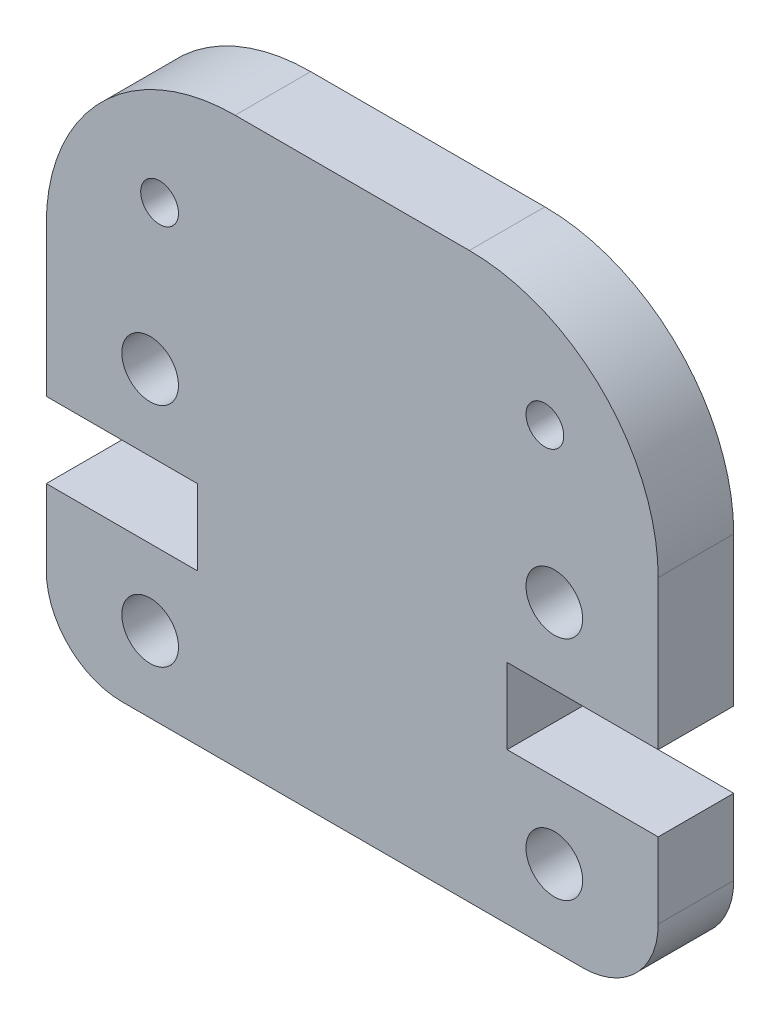
from build123d import *

# Parameters (mm, degrees)
SKETCH2_R           = 0.75
SKETCH2_R_2         = 0.5
BOSS_EXTRUDE1_DEPTH = 2


with BuildPart() as part:
    # Sketch2 → Boss-Extrude1 (new body)
    with BuildSketch(Plane.XY):
        with BuildLine():
            Line((0, 9.945), (0, 6))
            Line((0, 6), (4, 6))
            Line((4, 6), (4, 4))
            Line((4, 4), (0, 4))
            Line((0, 4), (0, 2))
            ThreePointArc((0, 2), (0.585786438, 0.585786438), (2, 0))
            Line((2, 0), (14.2, 0))
            ThreePointArc((14.2, 0), (15.614213562, 0.585786438), (16.2, 2))
            Line((16.2, 2), (16.2, 4))
            Line((16.2, 4), (12.2, 4))
            Line((12.2, 4), (12.2, 6))
            Line((12.2, 6), (16.2, 6))
            Line((16.2, 6), (16.2, 9.945))
            ThreePointArc((16.2, 9.945), (14.735533906, 13.480533906), (11.2, 14.945))
            Line((11.2, 14.945), (5, 14.945))
            ThreePointArc((5, 14.945), (1.464466094, 13.480533906), (0, 9.945))
        make_face()
        with Locations((13.45, 8)):
            Circle(SKETCH2_R, mode=Mode.SUBTRACT)
        with Locations(Location((13.45, 2, 0), (0, 0, 180))):
            Circle(SKETCH2_R, mode=Mode.SUBTRACT)
        with Locations(Location((13.2, 11.942, 0), (0, 0, 180))):
            Circle(SKETCH2_R_2, mode=Mode.SUBTRACT)
        with Locations((3, 11.942)):
            Circle(SKETCH2_R_2, mode=Mode.SUBTRACT)
        with Locations((2.75, 2)):
            Circle(SKETCH2_R, mode=Mode.SUBTRACT)
        with Locations(Location((2.75, 8, 0), (0, 0, 180))):
            Circle(SKETCH2_R, mode=Mode.SUBTRACT)
    extrude(amount=BOSS_EXTRUDE1_DEPTH)


solid = part.part
